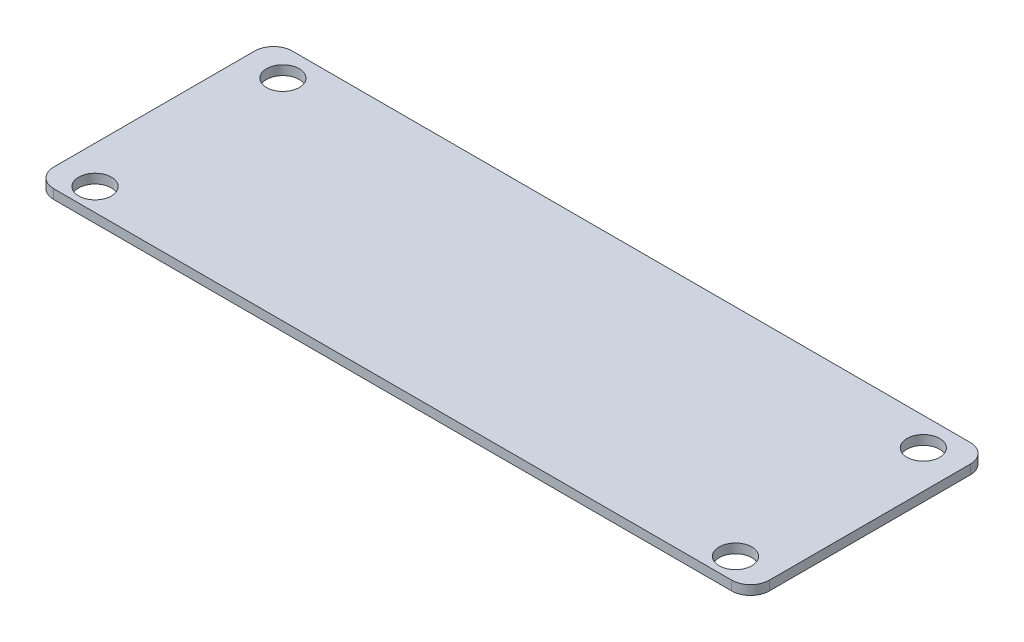
from build123d import *

# Parameters (mm, degrees)
SKETCH1_R           = 1.7399
BOSS_EXTRUDE1_DEPTH = 1


with BuildPart() as part:
    # Sketch1 → Boss-Extrude1 (new body)
    with BuildSketch(Plane(origin=(0, 0, 0), x_dir=(1, 0, 0), z_dir=(0, 1, 0))):
        with BuildLine():
            Line((-36.1, -12.7), (36.1, -12.7))
            ThreePointArc((36.1, -12.7), (37.514213562, -12.114213562), (38.1, -10.7))
            Line((38.1, -10.7), (38.1, 10.7))
            ThreePointArc((38.1, 10.7), (37.514213562, 12.114213562), (36.1, 12.7))
            Line((36.1, 12.7), (-36.1, 12.7))
            ThreePointArc((-36.1, 12.7), (-37.514213562, 12.114213562), (-38.1, 10.7))
            Line((-38.1, 10.7), (-38.1, -10.7))
            ThreePointArc((-38.1, -10.7), (-37.514213562, -12.114213562), (-36.1, -12.7))
        make_face()
        with Locations(Location((-34.1, 9.7, 0), (0, 0, 270))):
            Circle(SKETCH1_R, mode=Mode.SUBTRACT)
        with Locations(Location((-34.1, -10.3, 0), (0, 0, 270))):
            Circle(SKETCH1_R, mode=Mode.SUBTRACT)
        with Locations(Location((34.1, -10.3, 0), (0, 0, 90))):
            Circle(SKETCH1_R, mode=Mode.SUBTRACT)
        with Locations(Location((34.1, 9.7, 0), (0, 0, 90))):
            Circle(SKETCH1_R, mode=Mode.SUBTRACT)
    extrude(amount=BOSS_EXTRUDE1_DEPTH)


solid = part.part
